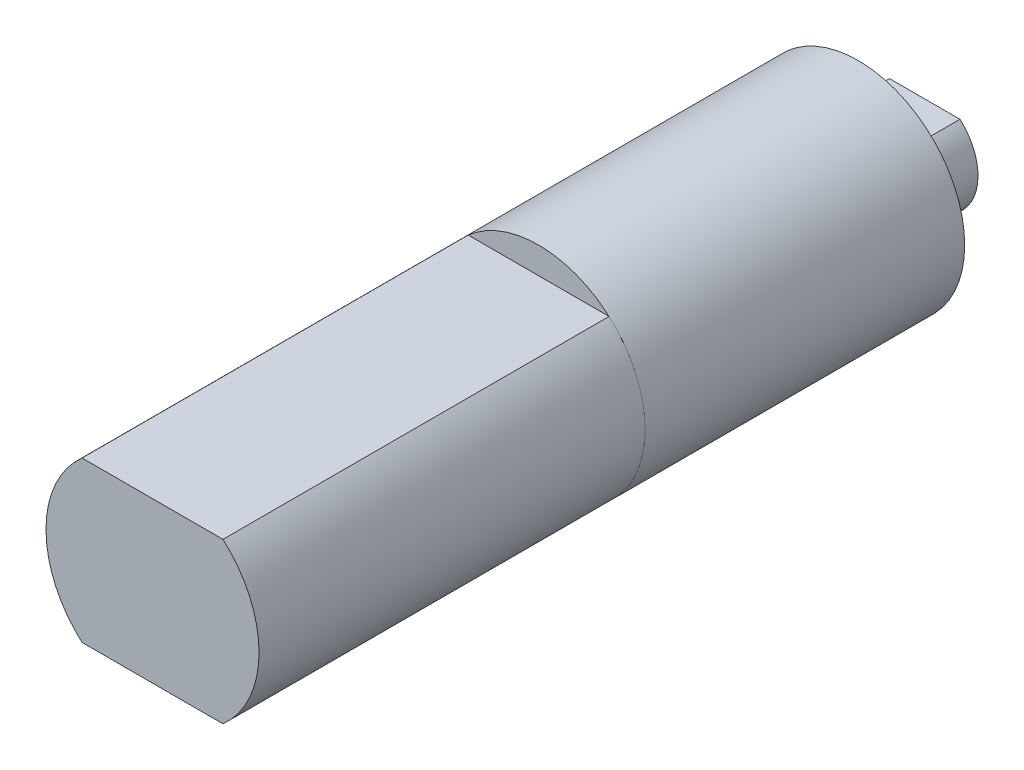
from build123d import *

# Parameters (mm, degrees)
SKETCH1_R           = 4
BOSS_EXTRUDE1_DEPTH = 12
SKETCH1_4_R         = 2
BOSS_EXTRUDE2_DEPTH = 2.5
BOSS_EXTRUDE3_DEPTH = 14.5
CUT_EXTRUDE1_START  = -2.5
CUT_EXTRUDE1_DEPTH  = 2.5


with BuildPart() as part:
    # Sketch1 → Boss-Extrude1 (new body)
    with BuildSketch(Plane.XY):
        Circle(SKETCH1_R)
    extrude(amount=BOSS_EXTRUDE1_DEPTH)

    # Sketch1<4> → Boss-Extrude2 (add)
    with BuildSketch(Plane.XY):
        Circle(SKETCH1_4_R)
    extrude(amount=-BOSS_EXTRUDE2_DEPTH)

    # Sketch3 → Cut-Extrude1 (cut)
    with BuildSketch(Plane(origin=(0, 0, -2.5), x_dir=(-1, 0, 0), z_dir=(0, 0, -1)).offset(CUT_EXTRUDE1_START)):
        with BuildLine():
            ThreePointArc((1.322875656, 1.5), (0, 2), (-1.322875656, 1.5))
            Line((-1.322875656, 1.5), (1.322875656, 1.5))
        make_face()
    extrude(amount=CUT_EXTRUDE1_DEPTH, mode=Mode.SUBTRACT)


with BuildPart() as body_2:
    # Sketch2 → Boss-Extrude3 (new body)
    with BuildSketch(Plane.XY.offset(12)):
        with BuildLine():
            Line((-2.645751311, 3), (2.645751311, 3))
            ThreePointArc((2.645751311, 3), (4, 0), (2.645751311, -3))
            Line((2.645751311, -3), (-2.645751311, -3))
            ThreePointArc((-2.645751311, -3), (-4, 0), (-2.645751311, 3))
        make_face()
    extrude(amount=BOSS_EXTRUDE3_DEPTH)


solid = Compound([part.part, body_2.part])
